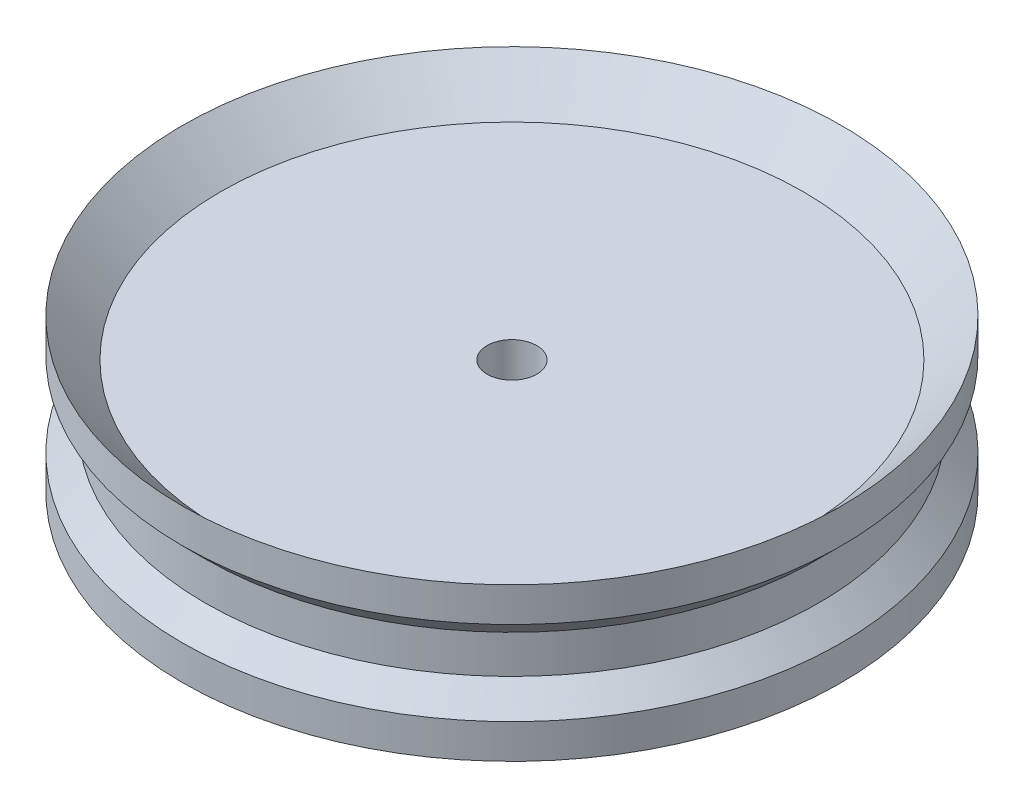
from build123d import *

# Parameters (mm, degrees)
CUT_EXTRUDE1_DEPTH      = 63.771171727
CUT_EXTRUDE1_DEPTH_BACK = 63.771171727
SKETCH6_R               = 3.25


with BuildPart() as part:
    # Sweep1: sweep along a path in Sketch1
    with BuildLine(Plane(origin=(0, 0, 0), x_dir=(1, 0, 0), z_dir=(0, 1, 0))) as sweep1_path:
        CenterArc((0, 0), 38.1, 0, 360)
    # Sketch2 → Sweep1 (sweep)
    with BuildSketch(Plane(origin=(0, 0, 0), x_dir=(0, 0, -1), z_dir=(1, 0, 0))):
        Polygon((-38.1, 5), (-43.1, 10), (-43.1, 5.5), (-40.1, 2.5), (-40.1, -2.5), (-43.1, -5.5), (-43.1, -10), (-38.1, -5), (0, -5), (0, 0), (0, 5), align=None)
    sweep(path=sweep1_path.line)

    # Sketch6 → Cut-Extrude1 (cut, two sides: drawn at the far end of the back side and taken through both)
    with BuildSketch(Plane(origin=(0, -5, 0), x_dir=(-1, 0, 0), z_dir=(0, -1, 0)).offset(-CUT_EXTRUDE1_DEPTH_BACK)):
        with Locations(Location((0, 0, 0), (0, 0, 270))):
            Circle(SKETCH6_R)
    extrude(amount=CUT_EXTRUDE1_DEPTH + CUT_EXTRUDE1_DEPTH_BACK, mode=Mode.SUBTRACT)


solid = part.part
